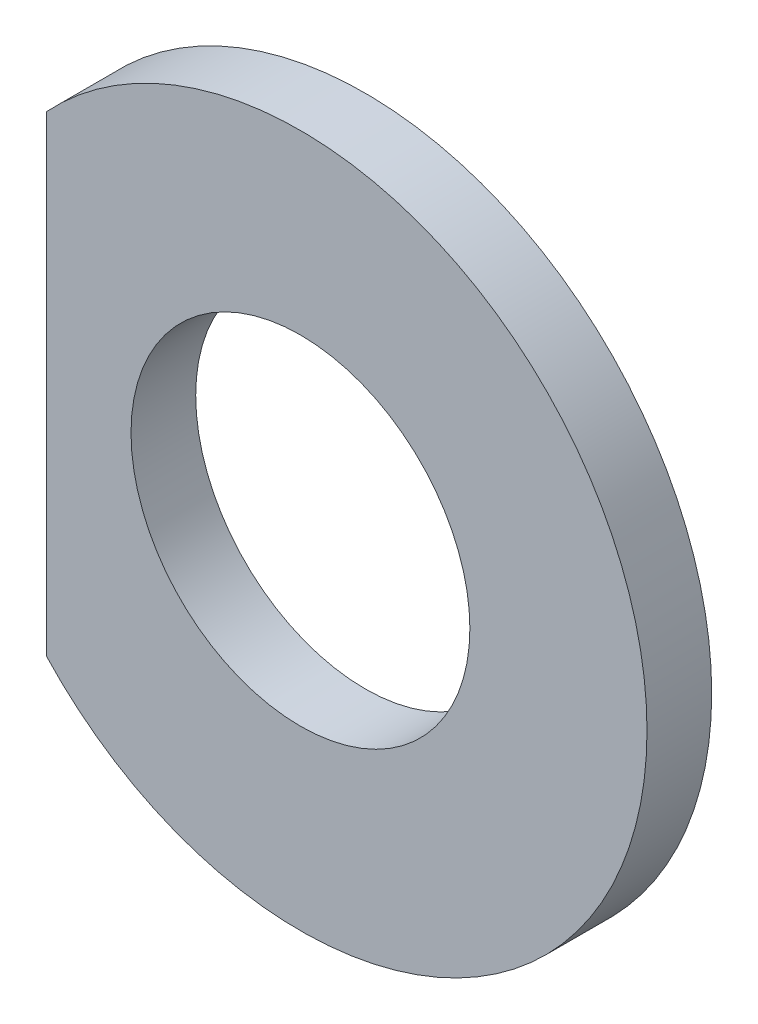
from build123d import *

# Parameters (mm, degrees)
SKETCH1_R      = 1.1
EXTRUDE1_DEPTH = 0.42


with BuildPart() as part:
    # Sketch1 → Extrude1 (new body)
    with BuildSketch(Plane.XY):
        with BuildLine():
            Line((-1.65, 1.529705854), (-1.65, -1.529705854))
            ThreePointArc((-1.65, -1.529705854), (2.25, 0), (-1.65, 1.529705854))
        make_face()
        Circle(SKETCH1_R, mode=Mode.SUBTRACT)
    extrude(amount=-EXTRUDE1_DEPTH)


solid = part.part
